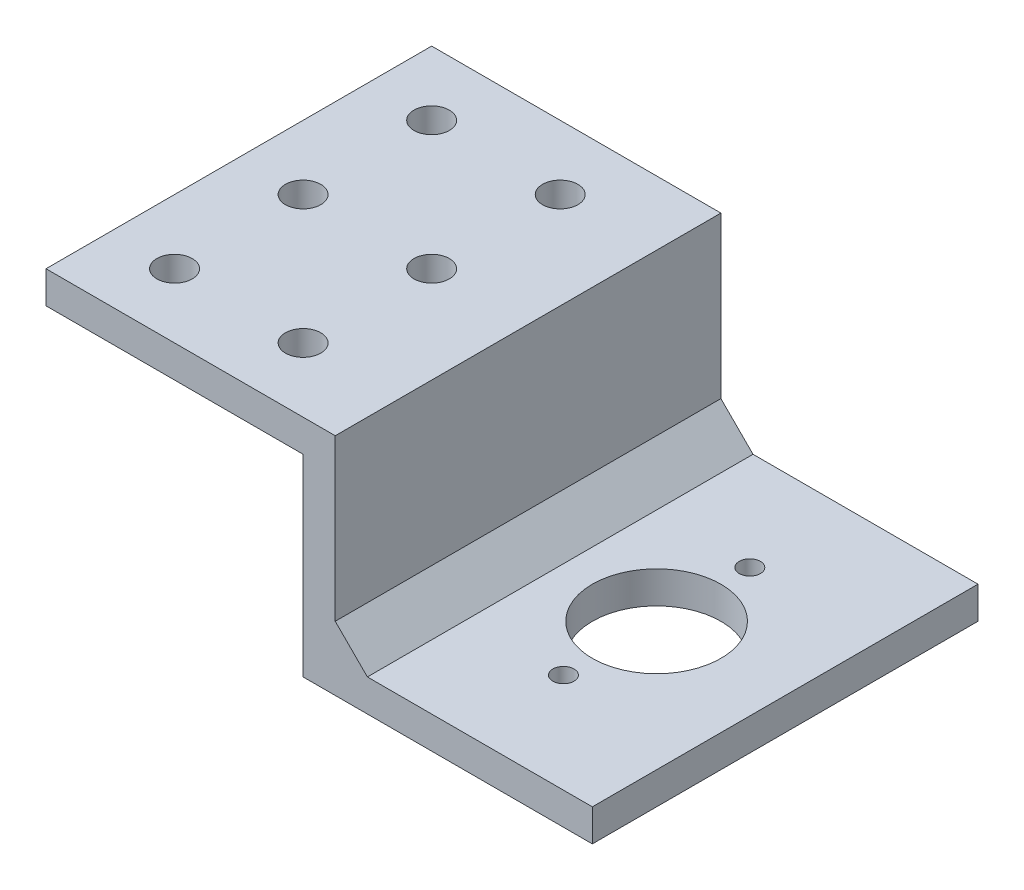
from build123d import *

# Parameters (mm, degrees)
EXTRUDE_1_DEPTH     = 60
SKETCH_2_R          = 2.75
CUT_EXTRUDE_1_DEPTH = 109.282039139
SKETCH_3_R          = 10
SKETCH_3_R_2        = 1.65
CUT_EXTRUDE_2_DEPTH = 109.282039139
CHAMFER_1_SIZE      = 5


with BuildPart() as part:
    # 草图1 → 凸台-拉伸1 (new body)
    with BuildSketch(Plane.XY):
        Polygon((0, 0), (-45, 0), (-45, 30), (-85, 30), (-85, 35), (-40, 35), (-40, 5), (0, 5), align=None)
    extrude(amount=EXTRUDE_1_DEPTH)

    # 草图2 → 切除-拉伸1 (cut, through all)
    with BuildSketch(Plane.XZ.offset(-30)):
        with Locations((-55, 50)):
            Circle(SKETCH_2_R)
        with Locations((-55, 30)):
            Circle(SKETCH_2_R)
        with Locations((-75, 30)):
            Circle(SKETCH_2_R)
        with Locations(Location((-55, 10, 0), (0, 0, 180))):
            Circle(SKETCH_2_R)
        with Locations((-75, 50)):
            Circle(SKETCH_2_R)
        with Locations((-75, 10)):
            Circle(SKETCH_2_R)
    extrude(amount=-CUT_EXTRUDE_1_DEPTH, mode=Mode.SUBTRACT)

    # 草图3 → 切除-拉伸2 (cut, through all)
    with BuildSketch(Plane(origin=(0, 5, 0), x_dir=(1, 0, 0), z_dir=(0, 1, 0))):
        with Locations(Location((-20, -30, 0), (0, 0, 180))):
            Circle(SKETCH_3_R)
        with Locations(Location((-20, -15.5, 0), (0, 0, 180))):
            Circle(SKETCH_3_R_2)
        with Locations(Location((-20, -44.5, 0), (0, 0, 180))):
            Circle(SKETCH_3_R_2)
    extrude(amount=-CUT_EXTRUDE_2_DEPTH, mode=Mode.SUBTRACT)

    # 倒角1
    chamfer_1_edges = [part.edges().sort_by_distance(p)[0] for p in [
        (-40, 5, 30),
    ]]
    chamfer(chamfer_1_edges, length=CHAMFER_1_SIZE)


solid = part.part
